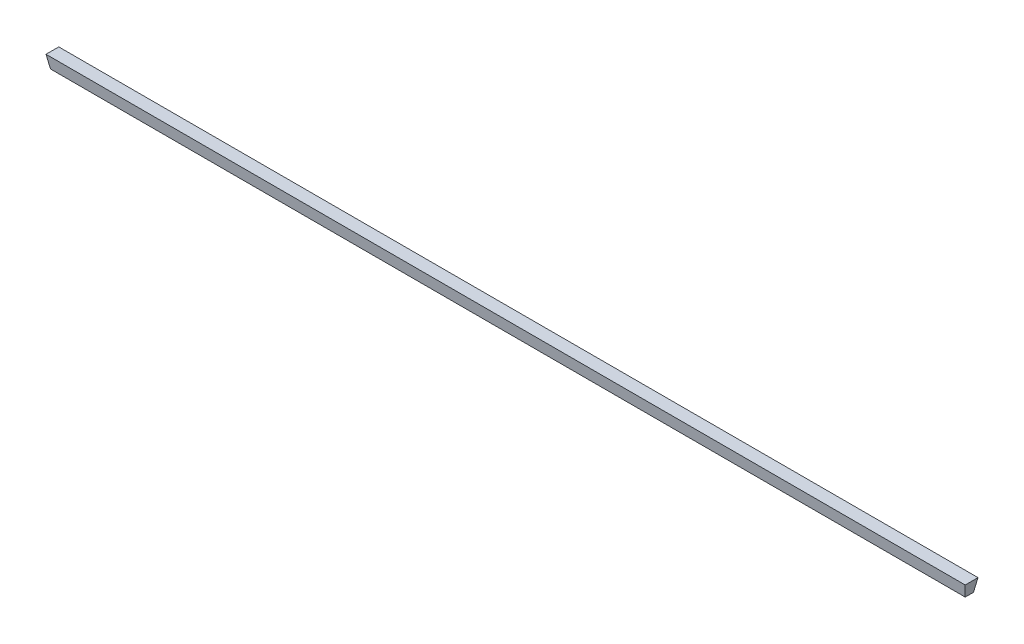
from build123d import *

# Parameters (mm, degrees)
SKETCH1_W           = 3657.6
SKETCH1_H           = 50.8
BOSS_EXTRUDE1_DEPTH = 50.8
BOSS_EXTRUDE1_DRAFT = -10


with BuildPart() as part:
    # Sketch1 → Boss-Extrude1 (with draft: the straight prism first)
    with BuildSketch(Plane(origin=(0, 0, 0), x_dir=(1, 0, 0), z_dir=(0, 1, 0))):
        Rectangle(SKETCH1_W, SKETCH1_H)
    extrude(amount=-BOSS_EXTRUDE1_DEPTH)
    # Boss-Extrude1: the draft: its side faces are tilted about the plane it starts from
    boss_extrude1_sides = [part.faces().sort_by_distance(p)[0] for p in [
        (-1828.8, -25.4, 0),
        (0, -25.4, 25.4),
        (1828.8, -25.4, 0),
        (0, -25.4, -25.4),
    ]]
    draft(boss_extrude1_sides, Plane(origin=(0, 0, 0), x_dir=(1, 0, 0), z_dir=(0, 1, 0)), BOSS_EXTRUDE1_DRAFT)


solid = part.part
